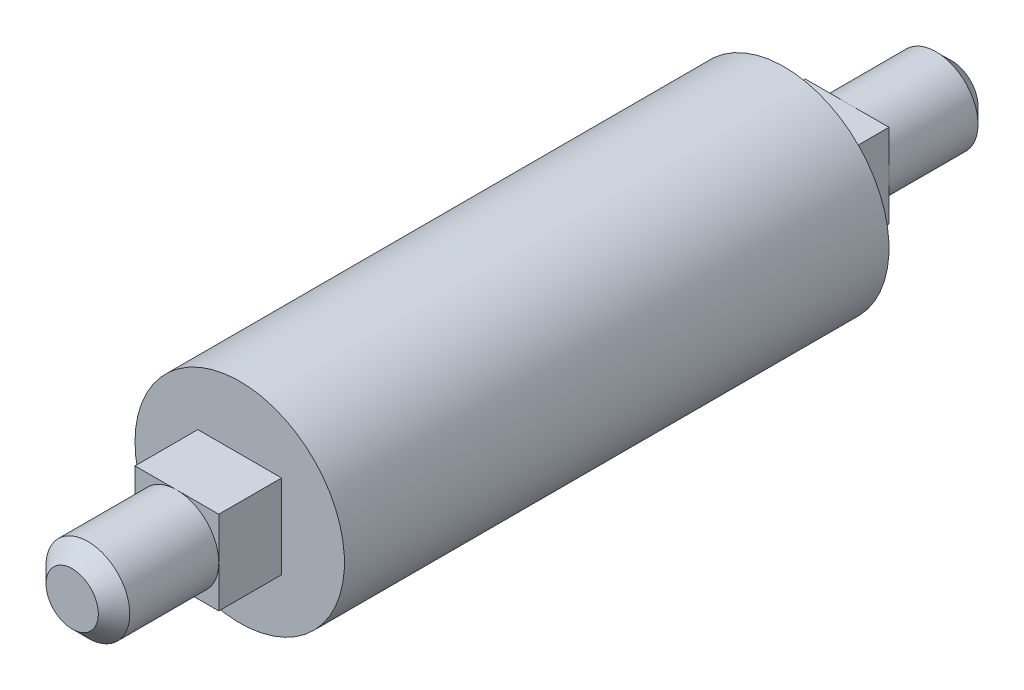
from build123d import *

# Parameters (mm, degrees)
SKIZZE1_R                       = 10
AUFSATZ_LINEAR_AUSTRAGEN1_DEPTH = 26
SKIZZE2_W                       = 8
SKIZZE2_H                       = 8
AUFSATZ_LINEAR_AUSTRAGEN2_DEPTH = 6
SKIZZE3_R                       = 4
AUFSATZ_LINEAR_AUSTRAGEN3_DEPTH = 10
FASE1_SIZE                      = 1.5


with BuildPart() as part:
    # Skizze1 → Aufsatz-Linear austragen1 (new body)
    with BuildSketch(Plane.XY):
        with Locations(Location((0, 0, 0), (0, 0, 180))):
            Circle(SKIZZE1_R)
    extrude(amount=AUFSATZ_LINEAR_AUSTRAGEN1_DEPTH)

    # Skizze2 → Aufsatz-Linear austragen2 (add)
    with BuildSketch(Plane.XY.offset(26)):
        Rectangle(SKIZZE2_W, SKIZZE2_H)
    extrude(amount=AUFSATZ_LINEAR_AUSTRAGEN2_DEPTH)

    # Skizze3 → Aufsatz-Linear austragen3 (add)
    with BuildSketch(Plane.XY.offset(32)):
        Circle(SKIZZE3_R)
    extrude(amount=AUFSATZ_LINEAR_AUSTRAGEN3_DEPTH)

    # Fase1
    fase1_edges = [part.edges().sort_by_distance(p)[0] for p in [
        (-4, 0, 42),
    ]]
    chamfer(fase1_edges, length=FASE1_SIZE)

    # Spiegeln1: part across plane


with BuildPart() as part_1:
    add(part.part)
    add(part.part.mirror(Plane.XY))


solid = part_1.part
